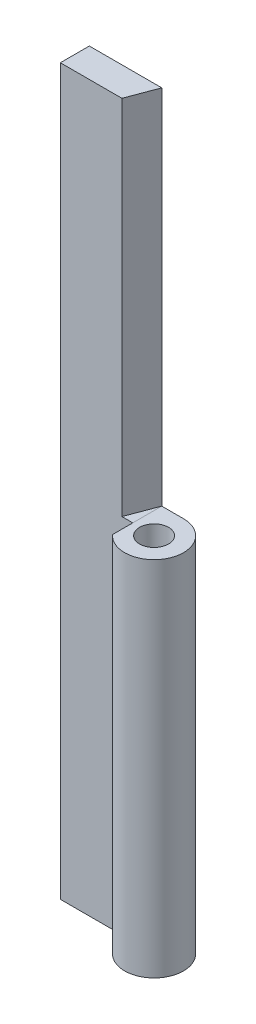
from build123d import *

# Parameters (mm, degrees)
SKETCH1_W           = 5
SKETCH1_H           = 50
BOSS_EXTRUDE1_DEPTH = 2
BOSS_EXTRUDE3_DEPTH = 25
SKETCH5_R           = 1
CUT_EXTRUDE2_DEPTH  = 51.884908237
CUT_EXTRUDE4_DEPTH  = 25


with BuildPart() as part:
    # Sketch1 → Boss-Extrude1 (new body)
    with BuildSketch(Plane.XY):
        with Locations((2.5, -25)):
            Rectangle(SKETCH1_W, SKETCH1_H)
    extrude(amount=BOSS_EXTRUDE1_DEPTH)

    # Sketch7 → Cut-Extrude4 (cut)
    with BuildSketch(Plane(origin=(0, 0, 0), x_dir=(1, 0, 0), z_dir=(0, 1, 0))):
        Polygon((5, 0), (4.25, -2), (5, -2), align=None)
    extrude(amount=-CUT_EXTRUDE4_DEPTH, mode=Mode.SUBTRACT)


with BuildPart() as body_2:
    # Sketch4 → Boss-Extrude3 (new body)
    with BuildSketch(Plane.XZ.offset(50)):
        with BuildLine():
            Line((5, 0), (6.5, 0))
            ThreePointArc((6.5, 0), (8.358090418, 2.850628125), (5, 3.4))
            Line((5, 3.4), (5, 0))
        make_face()
    extrude(amount=-BOSS_EXTRUDE3_DEPTH)

    # Sketch5 → Cut-Extrude2 (cut, through all)
    with BuildSketch(Plane.XZ.offset(50)):
        with Locations(Location((6.5, 2.030882353, 0), (0, 0, 270))):
            Circle(SKETCH5_R)
    extrude(amount=-CUT_EXTRUDE2_DEPTH, mode=Mode.SUBTRACT)


solid = Compound([part.part, body_2.part])
